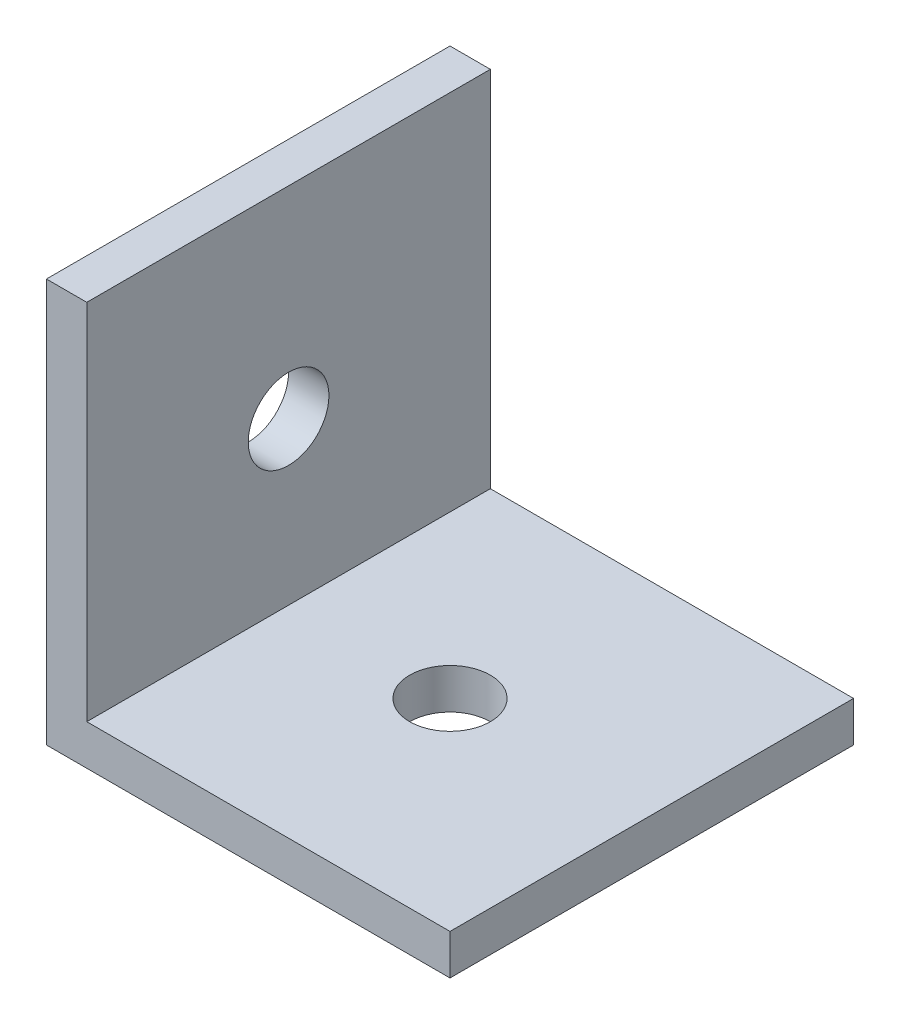
from build123d import *

# Parameters (mm, degrees)
EXTRUSION1_DEPTH = 15
ESQUISSE2_R      = 1.5
EXTRUSION2_DEPTH = 15
ESQUISSE3_R      = 1.5
EXTRUSION3_DEPTH = 15


with BuildPart() as part:
    # Esquisse1 → Extrusion1 (new body)
    with BuildSketch(Plane.XY):
        Polygon((-27.431265327, 3.864105263), (-27.431265327, -11.135894737), (-12.431265327, -11.135894737), (-12.431265327, -9.635894737), (-25.931265327, -9.635894737), (-25.931265327, 3.864105263), align=None)
    extrude(amount=EXTRUSION1_DEPTH)

    # Esquisse2 → Extrusion2 (cut)
    with BuildSketch(Plane(origin=(-25.931265327, 0, 0), x_dir=(0, 0, -1), z_dir=(1, 0, 0))):
        with Locations((-7.5, -3.635894737)):
            Circle(ESQUISSE2_R)
    extrude(amount=-EXTRUSION2_DEPTH, mode=Mode.SUBTRACT)

    # Esquisse3 → Extrusion3 (cut)
    with BuildSketch(Plane(origin=(0, -9.635894737, 0), x_dir=(-1, 0, 0), z_dir=(0, 1, 0))):
        with Locations((19.931265327, 7.5)):
            Circle(ESQUISSE3_R)
    extrude(amount=-EXTRUSION3_DEPTH, mode=Mode.SUBTRACT)


solid = part.part
